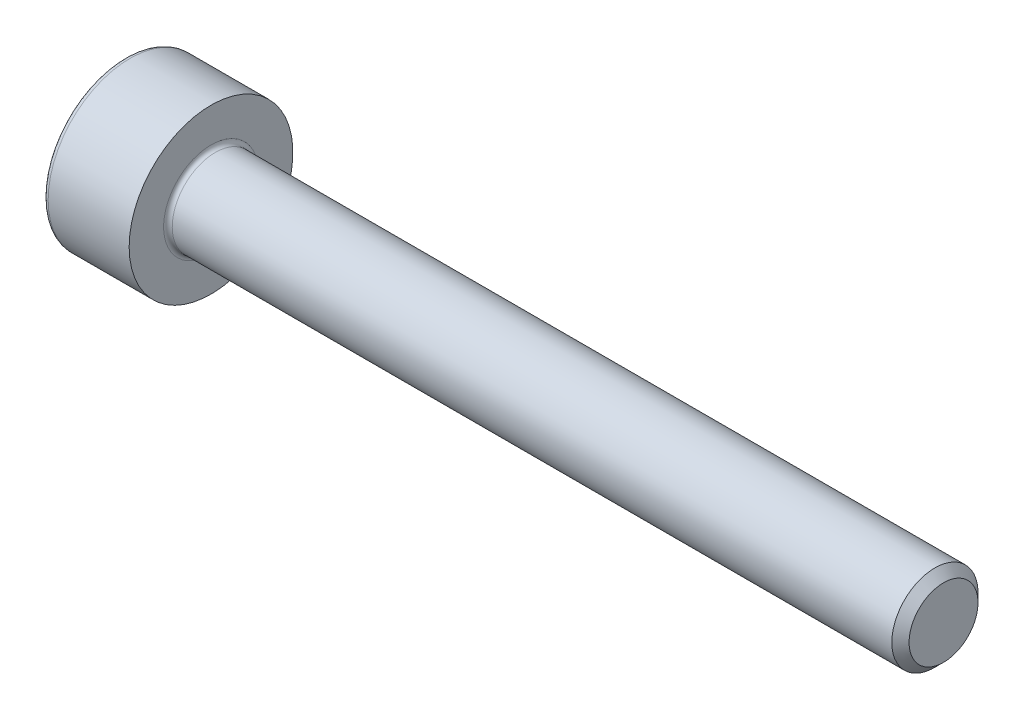
from build123d import *

# Parameters (mm, degrees)
FILLET1_R      = 0.1
FILLET2_R      = 0.12
CHAMFER1_SIZE  = 0.2
EXTRUDE1_DEPTH = 1


with BuildPart() as part:
    # Sketch1 → Revolve1 (revolve)
    with BuildSketch(Plane.XY, mode=Mode.PRIVATE) as revolve1_sk:
        Polygon((2, 1), (2, 0), (4.279914881, 0), (19, 0), (19, 1), align=None)
        Polygon((0, 1.9), (0, 0), (2, 0), (2, 1), (2, 1.9), align=None)
    revolve(revolve1_sk.sketch.rotate(Axis((0, 0, 0), (1, 0, 0)), 90), axis=Axis((0, 0, 0), (1, 0, 0)))

    # Fillet1
    fillet1_edges = [part.edges().sort_by_distance(p)[0] for p in [
        (2, 0, -1),
    ]]
    fillet(fillet1_edges, radius=FILLET1_R)

    # Fillet2
    fillet2_edges = [part.edges().sort_by_distance(p)[0] for p in [
        (0, 0, -1.9),
    ]]
    fillet(fillet2_edges, radius=FILLET2_R)

    # Chamfer1
    chamfer1_edges = [part.edges().sort_by_distance(p)[0] for p in [
        (19, 0, -1),
    ]]
    chamfer(chamfer1_edges, length=CHAMFER1_SIZE)

    # Sketch2 → Extrude1 (cut)
    with BuildSketch(Plane.ZY):
        Polygon((0, 0.866025404), (-0.75, 0.433012702), (-0.75, -0.433012702), (0, -0.866025404), (0.75, -0.433012702), (0.75, 0.433012702), align=None)
    extrude(amount=-EXTRUDE1_DEPTH, mode=Mode.SUBTRACT)


solid = part.part
